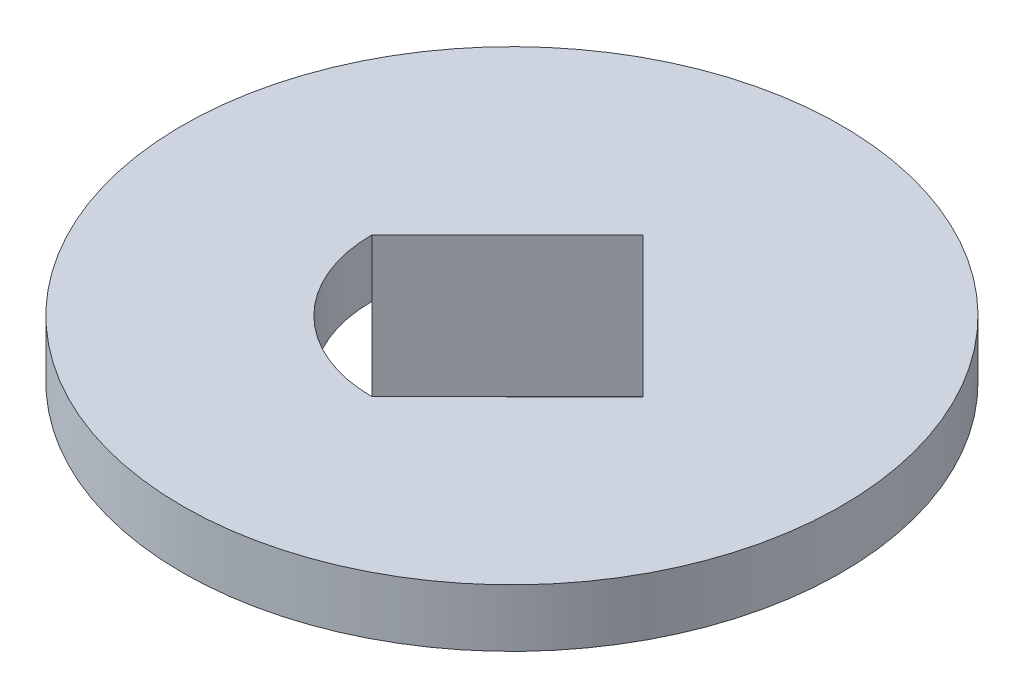
from build123d import *

# Parameters (mm, degrees)
SKETCH2_R           = 10
BOSS_EXTRUDE1_DEPTH = 1.75
BOSS_EXTRUDE2_DEPTH = 2.5
CUT_EXTRUDE1_START  = -2.5
CUT_EXTRUDE1_DEPTH  = 2.5


with BuildPart() as part:
    # Sketch2 → Boss-Extrude1 (new body)
    with BuildSketch(Plane(origin=(0, 0, 0), x_dir=(1, 0, 0), z_dir=(0, 1, 0))):
        with Locations(Location((0, 0, 0), (0, 0, 270))):
            Circle(SKETCH2_R)
    extrude(amount=BOSS_EXTRUDE1_DEPTH)

    # Sketch3 → Boss-Extrude2 (add)
    with BuildSketch(Plane.XZ):
        with BuildLine():
            Line((-4.25, 0), (-0.138270177, -4.111729823))
            Line((-0.138270177, -4.111729823), (4.119266685, 0.145807039))
            Line((4.119266685, 0.145807039), (0, 4.25))
            ThreePointArc((0, 4.25), (4.25, 0), (0, -4.25))
            ThreePointArc((0, -4.25), (-3.00520382, -3.00520382), (-4.25, 0))
        make_face()
    extrude(amount=BOSS_EXTRUDE2_DEPTH)

    # Sketch4 → Cut-Extrude1 (cut)
    with BuildSketch(Plane.XZ.offset(CUT_EXTRUDE1_START)):
        with BuildLine():
            Line((-0.138270177, -4.111729823), (4.119266685, 0.145807039))
            Line((4.119266685, 0.145807039), (0, 4.25))
            ThreePointArc((0, 4.25), (-3.00520382, 3.00520382), (-4.25, 0))
            Line((-4.25, 0), (-0.138270177, -4.111729823))
        make_face()
    extrude(amount=CUT_EXTRUDE1_DEPTH, mode=Mode.SUBTRACT)


solid = part.part
